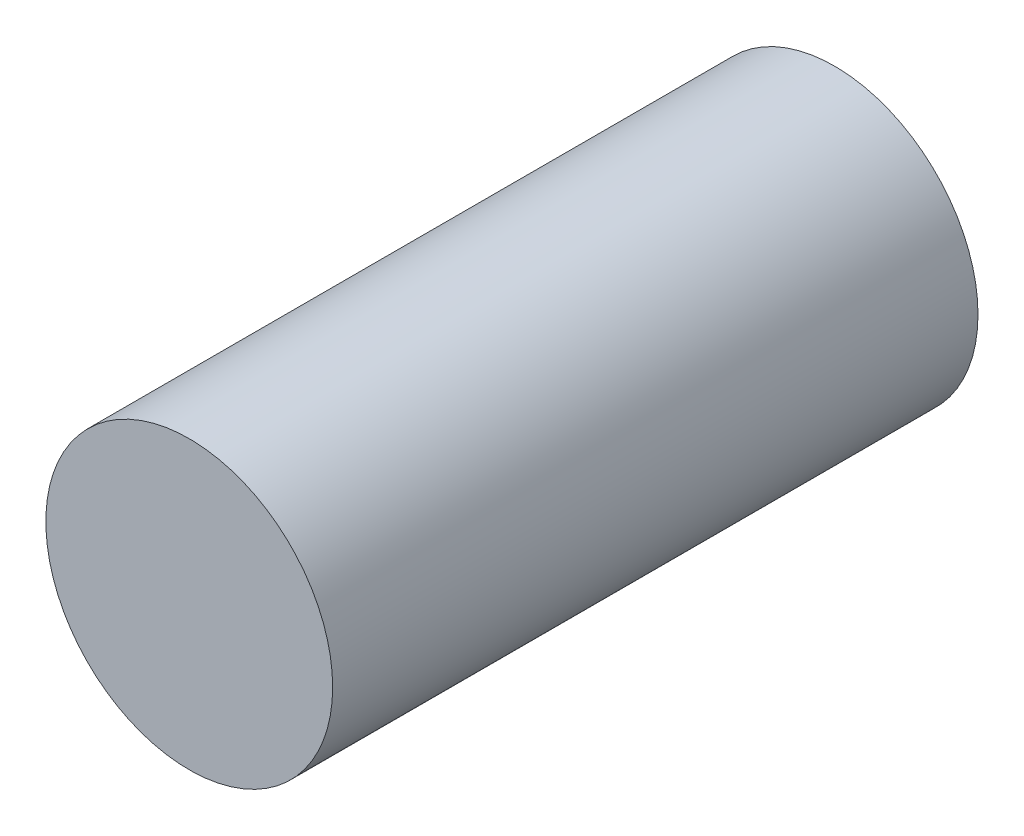
from build123d import *

# Parameters (mm, degrees)
SKETCH_1_R      = 30
EXTRUDE_1_DEPTH = 135


with BuildPart() as part:
    # 草图1 → 凸台-拉伸1 (new body)
    with BuildSketch(Plane.XY):
        Circle(SKETCH_1_R)
    extrude(amount=EXTRUDE_1_DEPTH)


solid = part.part
